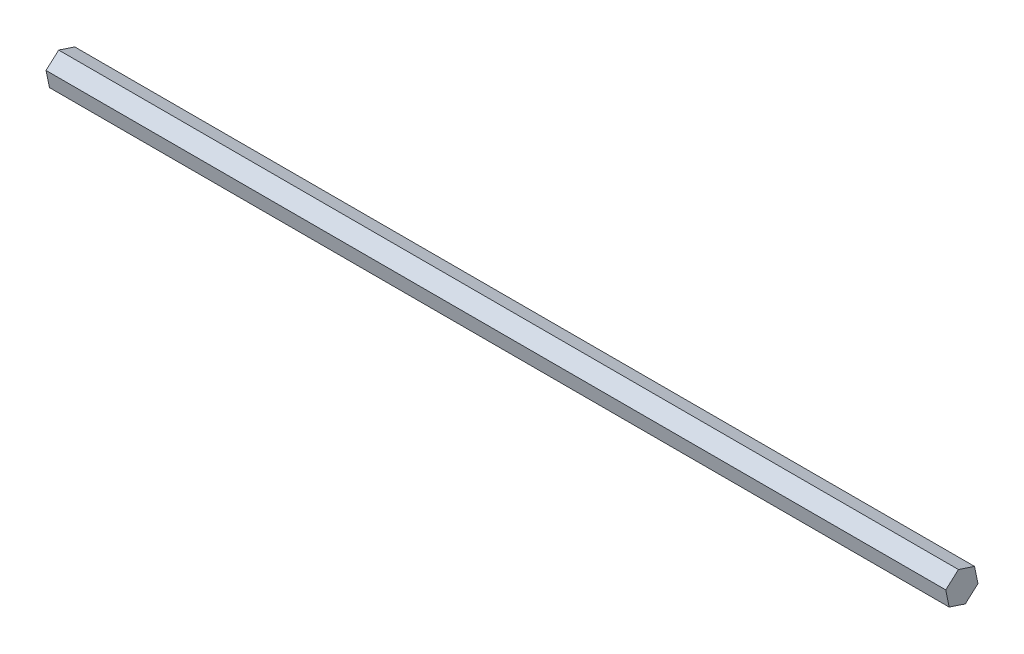
from build123d import *

# Parameters (mm, degrees)
BOSS_EXTRUDE1_DEPTH = 388.62


with BuildPart() as part:
    # Sketch1 → Boss-Extrude1 (new body)
    with BuildSketch(Plane(origin=(0, 0, 0), x_dir=(0, 0, -1), z_dir=(1, 0, 0))):
        Polygon((5.474043092, 4.878338402), (-1.487743439, 7.17982958), (-6.96178653, 2.301491178), (-5.474043092, -4.878338402), (1.487743439, -7.17982958), (6.96178653, -2.301491178), align=None)
    extrude(amount=BOSS_EXTRUDE1_DEPTH)


solid = part.part
